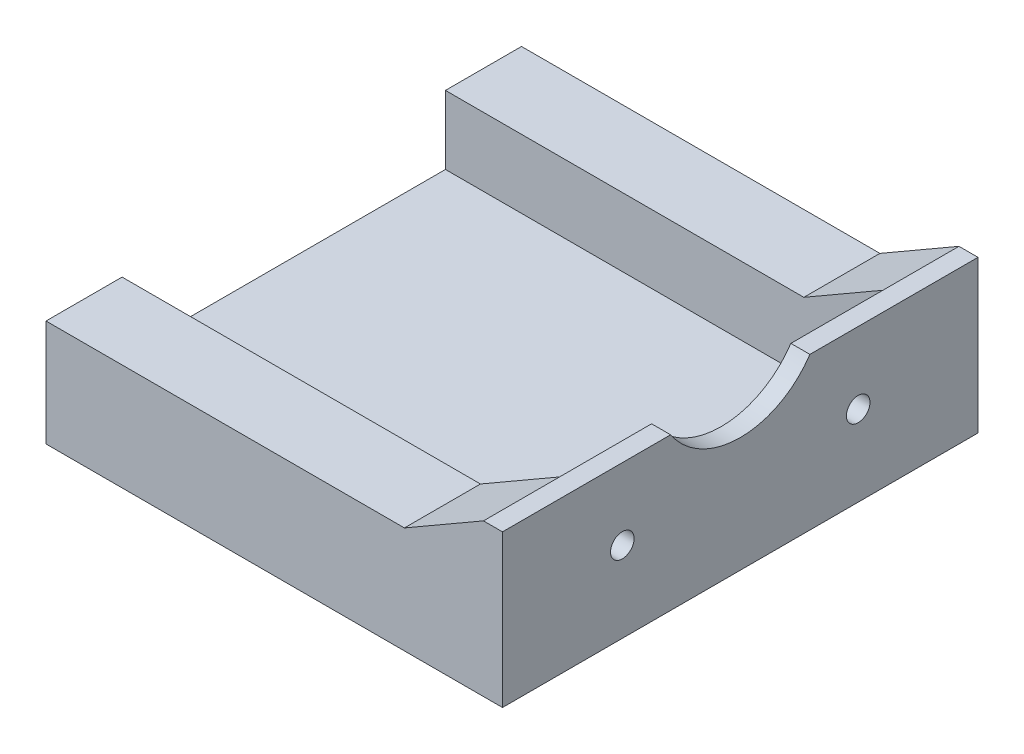
from build123d import *

# Parameters (mm, degrees)
SKETCH1_W            = 60
SKETCH1_H            = 62.5
BOSS_EXTRUDE1_DEPTH  = 5
BOSS_EXTRUDE2_DEPTH  = 2.5
BOSS_EXTRUDE3_DEPTH  = 10
BOSS_EXTRUDE4_DEPTH  = 10
SKETCH4_R            = 1.55
CUT_EXTRUDE1_DEPTH   = 10
M5_CLEARANCE_HOLE1_D = 6.4
SKETCH11_W           = 47.107695155
SKETCH11_H           = 10
BOSS_EXTRUDE5_DEPTH  = 2.5


with BuildPart() as part:
    # Sketch1 → Boss-Extrude1 (new body)
    with BuildSketch(Plane(origin=(0, 0, 0), x_dir=(1, 0, 0), z_dir=(0, 1, 0))):
        with Locations((30, 31.25)):
            Rectangle(SKETCH1_W, SKETCH1_H)
    extrude(amount=BOSS_EXTRUDE1_DEPTH)

    # Sketch2 → Boss-Extrude2 (add)
    with BuildSketch(Plane(origin=(60, 0, 0), x_dir=(0, 0, -1), z_dir=(1, 0, 0))):
        with BuildLine():
            Line((0, 20), (0, 5))
            Line((0, 5), (62.5, 5))
            Line((62.5, 5), (62.5, 20))
            Line((62.5, 20), (40.403687781, 20))
            ThreePointArc((40.403687781, 20), (31.25, 15.1), (22.096312219, 20))
            Line((22.096312219, 20), (0, 20))
        make_face()
    extrude(amount=-BOSS_EXTRUDE2_DEPTH)

    # Sketch3 → Boss-Extrude3 (add)
    with BuildSketch(Plane.XY):
        Polygon((57.5, 20), (31.519237886, 5), (57.5, 5), align=None)
    boss_extrude3 = extrude(amount=-BOSS_EXTRUDE3_DEPTH)

    # Sketch8 → Boss-Extrude4 (add)
    with BuildSketch(Plane(origin=(0, 0, 0), x_dir=(-1, 0, 0), z_dir=(0, 0, -1))):
        Polygon((-47.107695155, 14), (-47.107695155, 5), (-33.38717798, 5), (-24.156521096, 5), (0, 5), (0, 14), align=None)
    boss_extrude4 = extrude(amount=BOSS_EXTRUDE4_DEPTH)

    # Mirror1: Boss-Extrude3, Boss-Extrude4 across plane
    add(boss_extrude3.mirror(Plane.XY.offset(-31.25)))
    add(boss_extrude4.mirror(Plane.XY.offset(-31.25)))

    # Sketch4 → Cut-Extrude1 (cut)
    with BuildSketch(Plane(origin=(60, 0, 0), x_dir=(0, 0, -1), z_dir=(1, 0, 0))):
        with Locations((15.75, 10.6)):
            Circle(SKETCH4_R)
        with Locations((46.75, 10.6)):
            Circle(SKETCH4_R)
    extrude(amount=-CUT_EXTRUDE1_DEPTH, mode=Mode.SUBTRACT)

    # M5 Clearance Hole1 (through all)
    with Locations(Plane(origin=(0, 0, 0), x_dir=(-1, 0, 0), z_dir=(0, -1, 0))):
        with Locations((-40, 57.5), (-10, 57.5), (-40, 5), (-10, 5)):
            Hole(M5_CLEARANCE_HOLE1_D / 2)

    # Sketch11 → Boss-Extrude5 (add)
    with BuildSketch(Plane(origin=(0, 14, 0), x_dir=(1, 0, 0), z_dir=(0, 1, 0))):
        with Locations((23.553847578, 57.5)):
            Rectangle(SKETCH11_W, SKETCH11_H)
        with Locations((23.553847578, 5)):
            Rectangle(SKETCH11_W, SKETCH11_H)
    extrude(amount=-BOSS_EXTRUDE5_DEPTH)


solid = part.part
